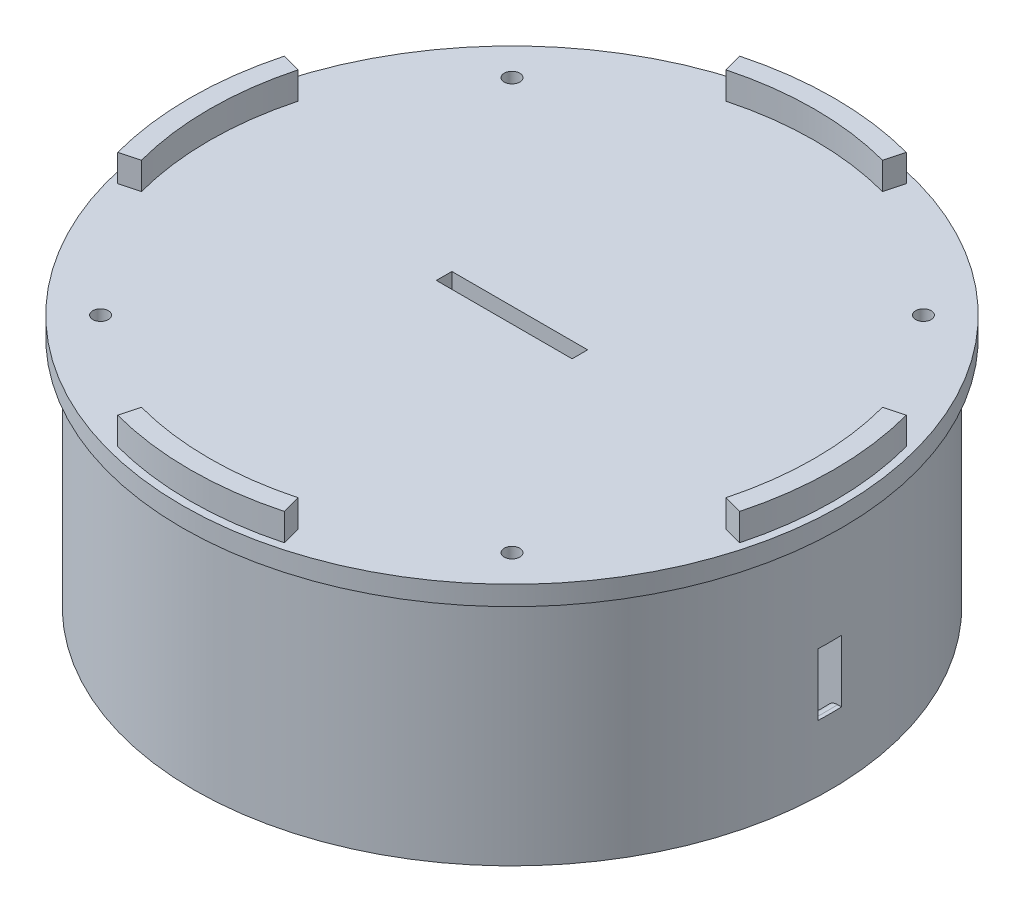
from build123d import *

# Parameters (mm, degrees)
SKETCH1_R                   = 85
BOSS_EXTRUDE1_DEPTH         = 5
SKETCH14_R                  = 2
CUT_EXTRUDE2_DEPTH          = 133
SKETCH16_W                  = 35
SKETCH16_H                  = 4
CUT_EXTRUDE4_DEPTH          = 10
BOSS_EXTRUDE2_DEPTH         = 7
BOSS_EXTRUDE3_START         = 60
SKETCH20_R                  = 82
SKETCH20_R_2                = 78
BOSS_EXTRUDE3_DEPTH         = 60
BOSS_EXTRUDE4_START         = 60
BOSS_EXTRUDE4_DEPTH         = 60
SKETCH23_R                  = 1.5
CUT_EXTRUDE5_DEPTH          = 25
CUT_EXTRUDE6_DEPTH          = 110
CUT_EXTRUDE6_DEPTH_BACK     = 105
FILLET1_R                   = 3
SKETCH27_W                  = 14
SKETCH27_H                  = 14
BOSS_EXTRUDE5_DEPTH         = 5
CIRPATTERN1_COUNT           = 2
CIRPATTERN1_ANGLE           = 90
CIRPATTERN1_COPY_1_SKETCH_W = 14
CIRPATTERN1_COPY_1_SKETCH_H = 14
CIRPATTERN1_COPY_1_DEPTH    = 5
SKETCH29_R                  = 1.25
CUT_EXTRUDE7_DEPTH          = 5
CIRPATTERN2_COUNT           = 4


with BuildPart() as part:
    # Sketch1 → Boss-Extrude1 (new body)
    with BuildSketch(Plane(origin=(0, 0, 0), x_dir=(1, 0, 0), z_dir=(0, 1, 0))):
        with Locations(Location((0, 0, 0), (0, 0, 270))):
            Circle(SKETCH1_R)
    extrude(amount=BOSS_EXTRUDE1_DEPTH)

    # Sketch14 → Cut-Extrude2 (cut)
    with BuildSketch(Plane(origin=(0, 5, 0), x_dir=(1, 0, 0), z_dir=(0, 1, 0))):
        with Locations(Location((-53.033008589, 53.033008589, 0), (0, 0, 270))):
            Circle(SKETCH14_R)
        with Locations(Location((53.033008589, 53.033008589, 0), (0, 0, 270))):
            Circle(SKETCH14_R)
        with Locations(Location((53.033008589, -53.033008589, 0), (0, 0, 270))):
            Circle(SKETCH14_R)
        with Locations(Location((-53.033008589, -53.033008589, 0), (0, 0, 270))):
            Circle(SKETCH14_R)
    extrude(amount=-CUT_EXTRUDE2_DEPTH, mode=Mode.SUBTRACT)

    # Sketch16 → Cut-Extrude4 (cut)
    with BuildSketch(Plane(origin=(0, 5, 0), x_dir=(1, 0, 0), z_dir=(0, 1, 0))):
        Rectangle(SKETCH16_W, SKETCH16_H)
    extrude(amount=-CUT_EXTRUDE4_DEPTH, mode=Mode.SUBTRACT)

    # Sketch19 → Boss-Extrude2 (add)
    with BuildSketch(Plane(origin=(0, 5, 0), x_dir=(1, 0, 0), z_dir=(0, 1, 0))):
        with BuildLine():
            Line((75.342214451, 20.187885518), (80.171843582, 21.481980744))
            ThreePointArc((80.171843582, 21.481980744), (83, 0), (80.171843582, -21.481980744))
            Line((80.171843582, -21.481980744), (75.342214451, -20.187885518))
            ThreePointArc((75.342214451, -20.187885518), (78, 0), (75.342214451, 20.187885518))
        make_face()
        with BuildLine():
            Line((20.187885518, -75.342214451), (21.481980744, -80.171843582))
            ThreePointArc((21.481980744, -80.171843582), (0, -83), (-21.481980744, -80.171843582))
            Line((-21.481980744, -80.171843582), (-20.187885518, -75.342214451))
            ThreePointArc((-20.187885518, -75.342214451), (0, -78), (20.187885518, -75.342214451))
        make_face()
        with BuildLine():
            Line((-75.342214451, -20.187885518), (-80.171843582, -21.481980744))
            ThreePointArc((-80.171843582, -21.481980744), (-83, 0), (-80.171843582, 21.481980744))
            Line((-80.171843582, 21.481980744), (-75.342214451, 20.187885518))
            ThreePointArc((-75.342214451, 20.187885518), (-78, 0), (-75.342214451, -20.187885518))
        make_face()
        with BuildLine():
            Line((-20.187885518, 75.342214451), (-21.481980744, 80.171843582))
            ThreePointArc((-21.481980744, 80.171843582), (0, 83), (21.481980744, 80.171843582))
            Line((21.481980744, 80.171843582), (20.187885518, 75.342214451))
            ThreePointArc((20.187885518, 75.342214451), (0, 78), (-20.187885518, 75.342214451))
        make_face()
    extrude(amount=BOSS_EXTRUDE2_DEPTH)

    # Sketch20 → Boss-Extrude3 (add)
    with BuildSketch(Plane.XZ.offset(BOSS_EXTRUDE3_START)):
        with Locations(Location((0, 0, 0), (0, 0, 90))):
            Circle(SKETCH20_R)
        with Locations(Location((0, 0, 0), (0, 0, 270))):
            Circle(SKETCH20_R_2, mode=Mode.SUBTRACT)
    extrude(amount=-BOSS_EXTRUDE3_DEPTH)

    # Sketch22 → Boss-Extrude4 (add)
    with BuildSketch(Plane.XZ.offset(BOSS_EXTRUDE4_START)):
        with BuildLine():
            Line((-65, -7), (-65, -3))
            Line((-65, -3), (-77.942286341, -3))
            ThreePointArc((-77.942286341, -3), (-77.839472536, -5.00165126), (-77.685262438, -7))
            Line((-77.685262438, -7), (-65, -7))
        make_face()
        with BuildLine():
            ThreePointArc((-77.685262438, -7), (-77.839472536, -5.00165126), (-77.942286341, -3))
            Line((-77.942286341, -3), (-80.944425379, -3))
            ThreePointArc((-80.944425379, -3), (-80.845437043, -5.001530694), (-80.696964007, -7))
            Line((-80.696964007, -7), (-77.685262438, -7))
        make_face()
        with BuildLine():
            ThreePointArc((77.685262438, 7), (77.839472536, 5.00165126), (77.942286341, 3))
            Line((77.942286341, 3), (80.944425379, 3))
            ThreePointArc((80.944425379, 3), (80.845437043, 5.001530694), (80.696964007, 7))
            Line((80.696964007, 7), (77.685262438, 7))
        make_face()
        with BuildLine():
            Line((65, 3), (77.942286341, 3))
            ThreePointArc((77.942286341, 3), (77.839472536, 5.00165126), (77.685262438, 7))
            Line((77.685262438, 7), (65, 7))
            Line((65, 7), (65, 3))
        make_face()
        with BuildLine():
            Line((77.942286341, -3), (65, -3))
            Line((65, -3), (65, -7))
            Line((65, -7), (77.685262438, -7))
            ThreePointArc((77.685262438, -7), (77.839472536, -5.00165126), (77.942286341, -3))
        make_face()
        with BuildLine():
            Line((80.944425379, -3), (77.942286341, -3))
            ThreePointArc((77.942286341, -3), (77.839472536, -5.00165126), (77.685262438, -7))
            Line((77.685262438, -7), (80.696964007, -7))
            ThreePointArc((80.696964007, -7), (80.845437043, -5.001530694), (80.944425379, -3))
        make_face()
        with BuildLine():
            Line((-80.696964007, 7), (-65, 7))
            Line((-65, 7), (-65, 3))
            Line((-65, 3), (-80.944425379, 3))
            ThreePointArc((-80.944425379, 3), (-80.845437043, 5.001530694), (-80.696964007, 7))
        make_face()
    boss_extrude4 = extrude(amount=-BOSS_EXTRUDE4_DEPTH)

    # Sketch23 → Cut-Extrude5 (cut)
    with BuildSketch(Plane.XY.offset(7)):
        with Locations((-70, -30)):
            Circle(SKETCH23_R)
    cut_extrude5 = extrude(amount=-CUT_EXTRUDE5_DEPTH, mode=Mode.SUBTRACT)

    # Mirror1: Cut-Extrude5 across plane
    add(cut_extrude5.mirror(Plane(origin=(0, 0, 0), x_dir=(0, 0, 1), z_dir=(1, 0, 0))), mode=Mode.SUBTRACT)

    # Sketch25 → Cut-Extrude6 (cut, two sides: drawn at the far end of the back side and taken through both)
    with BuildSketch(Plane(origin=(0, 0, 0), x_dir=(0, 0, -1), z_dir=(1, 0, 0)).offset(-CUT_EXTRUDE6_DEPTH_BACK)):
        Polygon((-3, -27), (3, -27), (3, -33), (3, -43), (-3, -43), (-3, -33), align=None)
    extrude(amount=CUT_EXTRUDE6_DEPTH + CUT_EXTRUDE6_DEPTH_BACK, mode=Mode.SUBTRACT)

    # Fillet1
    fillet1_edges = [part.edges().sort_by_distance(p)[0] for p in [
        (-78, -27, 0),
        (78, -27, 0),
        (-78, -43, 0),
        (78, -43, 0),
    ]]
    fillet(fillet1_edges, radius=FILLET1_R)

    # Sketch27 → Boss-Extrude5 (add)
    with BuildSketch(Plane.XZ.offset(60)):
        with Locations((-72, 0)):
            Rectangle(SKETCH27_W, SKETCH27_H)
    boss_extrude5 = extrude(amount=-BOSS_EXTRUDE5_DEPTH)

    # Mirror2: Boss-Extrude5 across plane
    add(boss_extrude5.mirror(Plane(origin=(0, 0, 0), x_dir=(0, 0, 1), z_dir=(1, 0, 0))))

    # CirPattern1: Boss-Extrude4, Boss-Extrude5 ×2 about axis
    cirpattern1_axis = Axis((0, 0, 0), (0, -1, 0))
    add([boss_extrude4.rotate(cirpattern1_axis, i * CIRPATTERN1_ANGLE / (CIRPATTERN1_COUNT - 1)) for i in range(1, CIRPATTERN1_COUNT)])
    add([boss_extrude5.rotate(cirpattern1_axis, i * CIRPATTERN1_ANGLE / (CIRPATTERN1_COUNT - 1)) for i in range(1, CIRPATTERN1_COUNT)])

    # CirPattern1 copy 1 sketch → CirPattern1 copy 1 (add)
    with BuildSketch(Plane(origin=(0, -60, 0), x_dir=(0, 0, -1), z_dir=(0, -1, 0))):
        with Locations((-72, 0)):
            Rectangle(CIRPATTERN1_COPY_1_SKETCH_W, CIRPATTERN1_COPY_1_SKETCH_H)
    extrude(amount=-CIRPATTERN1_COPY_1_DEPTH)

    # Sketch29 → Cut-Extrude7 (cut)
    with BuildSketch(Plane.XZ.offset(60)):
        with Locations(Location((-72.5, 0, 0), (0, 0, 270))):
            Circle(SKETCH29_R)
    cut_extrude7 = extrude(amount=-CUT_EXTRUDE7_DEPTH, mode=Mode.SUBTRACT)

    # CirPattern2: Cut-Extrude7 ×4 about axis
    cirpattern2_axis = Axis((0, 0, 0), (0, 1, 0))
    for i in range(1, CIRPATTERN2_COUNT):
        add(cut_extrude7.rotate(cirpattern2_axis, i * 360 / CIRPATTERN2_COUNT), mode=Mode.SUBTRACT)


solid = part.part
